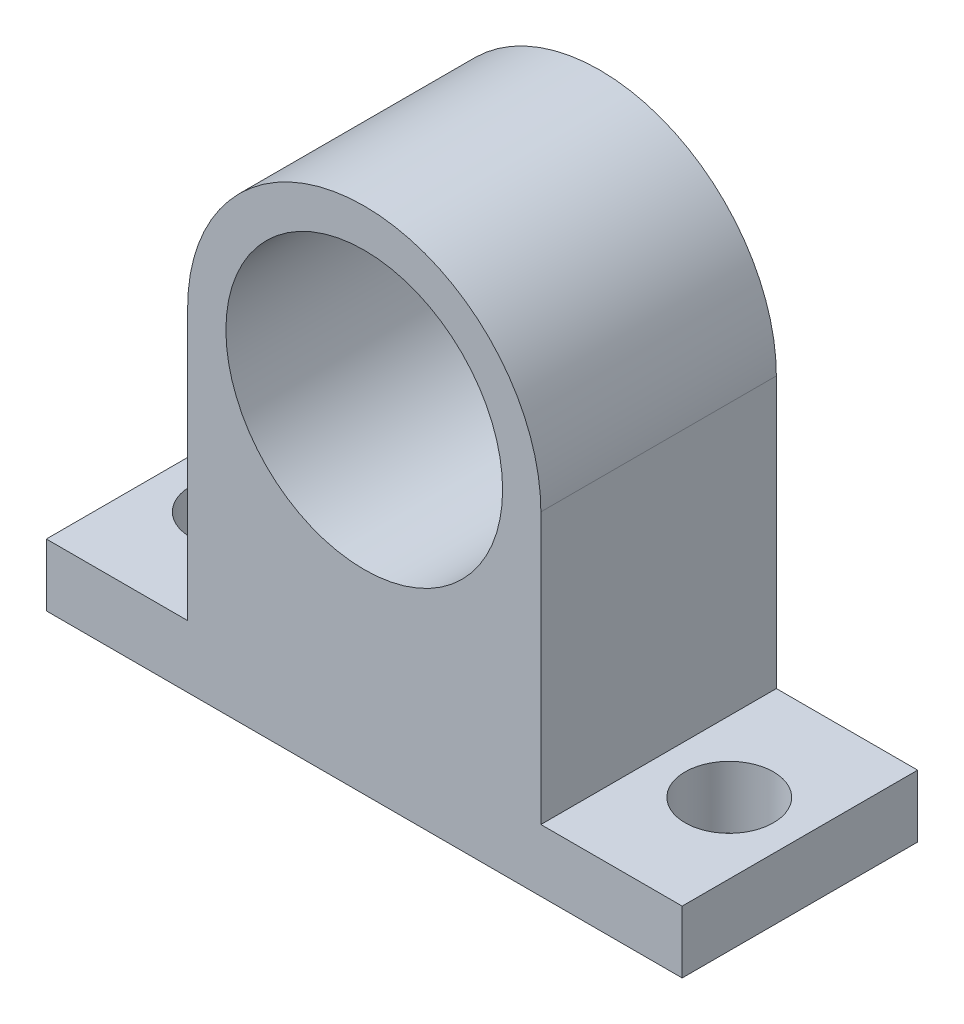
from build123d import *

# Parameters (mm, degrees)
SKETCH1_R               = 23.5
BOSS_EXTRUDE1_DEPTH     = 40
CUT_EXTRUDE1_DEPTH      = 102.443199391
CUT_EXTRUDE1_DEPTH_BACK = 102.443199391
SKETCH2_R               = 7.5


with BuildPart() as part:
    # Sketch1 → Boss-Extrude1 (new body)
    with BuildSketch(Plane.XY):
        with BuildLine():
            Line((-30, 0), (-30, -45.991596264))
            Line((-30, -45.991596264), (-54, -45.991596264))
            Line((-54, -45.991596264), (-54, -56.568744975))
            Line((-54, -56.568744975), (54, -56.568744975))
            Line((54, -56.568744975), (54, -45.991596264))
            Line((54, -45.991596264), (30, -45.991596264))
            Line((30, -45.991596264), (30, 0))
            ThreePointArc((30, 0), (0, 30), (-30, 0))
        make_face()
        Circle(SKETCH1_R, mode=Mode.SUBTRACT)
    extrude(amount=BOSS_EXTRUDE1_DEPTH)

    # Sketch2 → Cut-Extrude1 (cut, two sides: drawn at the far end of the back side and taken through both)
    with BuildSketch(Plane(origin=(0, -45.991596264, 0), x_dir=(1, 0, 0), z_dir=(0, 1, 0)).offset(-CUT_EXTRUDE1_DEPTH_BACK)):
        with Locations(Location((42, -20, 0), (0, 0, 180))):
            Circle(SKETCH2_R)
        with Locations(Location((-42, -20, 0), (0, 0, 90))):
            Circle(SKETCH2_R)
    extrude(amount=CUT_EXTRUDE1_DEPTH + CUT_EXTRUDE1_DEPTH_BACK, mode=Mode.SUBTRACT)


solid = part.part
